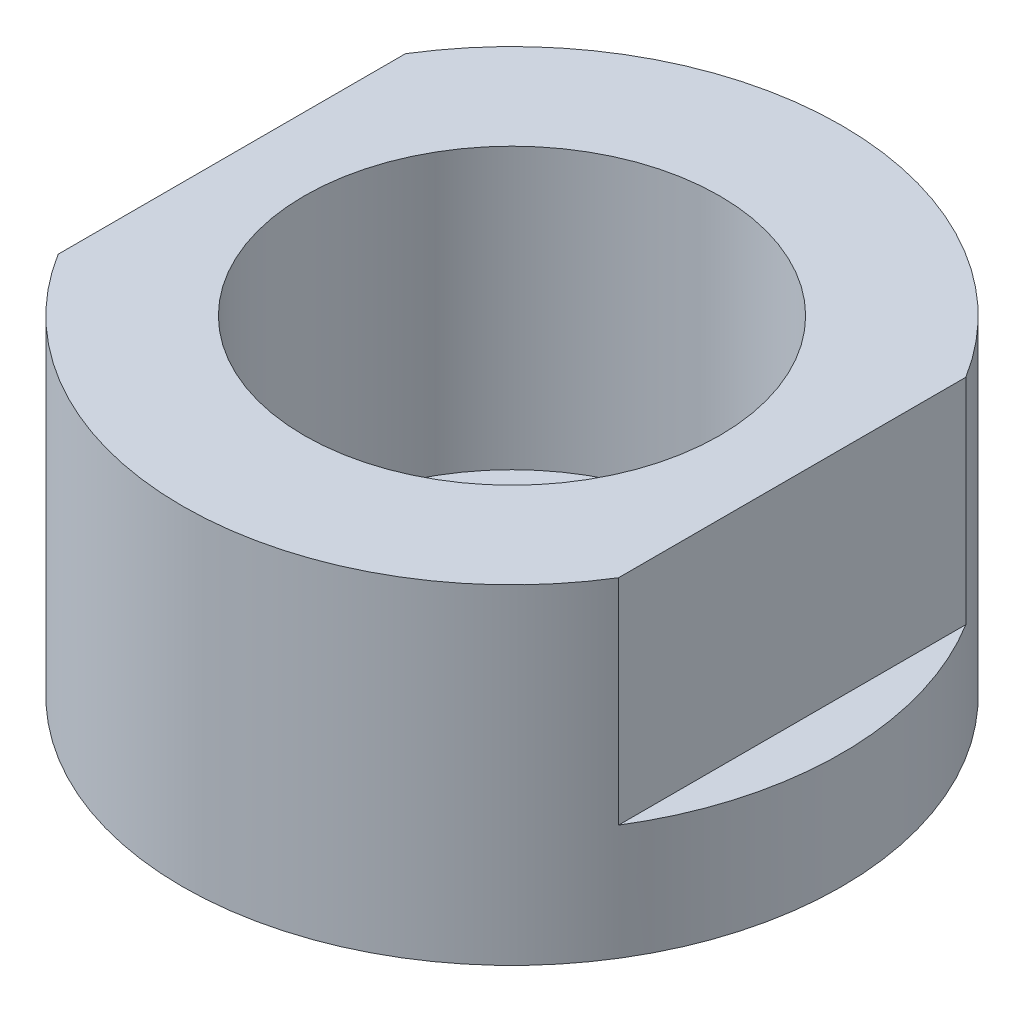
from build123d import *

# Parameters (mm, degrees)
SKETCH1_R                           = 25.4
BOSS_EXTRUDE1_DEPTH                 = 25.4
SKETCH2_R                           = 16
CUT_EXTRUDE1_DEPTH                  = 21.59
CUT_EXTRUDE2_REACH                  = 45.994
CUT_EXTRUDE2_END_RADIUS             = 25.4
SKETCH3_W                           = 3.81
SKETCH3_H                           = 16.51
CUT_EXTRUDE2_DIRECTION_2_REACH      = 45.994
CUT_EXTRUDE2_DIRECTION_2_END_RADIUS = 25.4
CUT_EXTRUDE3_REACH                  = 43.91
SKETCH4_R                           = 1


with BuildPart() as part:
    # Sketch1 → Boss-Extrude1 (new body)
    with BuildSketch(Plane(origin=(0, 0, 0), x_dir=(1, 0, 0), z_dir=(0, 1, 0))):
        with Locations(Location((0, 0, 0), (0, 0, 270))):
            Circle(SKETCH1_R)
    extrude(amount=BOSS_EXTRUDE1_DEPTH)

    # Sketch2 → Cut-Extrude1 (cut)
    with BuildSketch(Plane(origin=(0, 25.4, 0), x_dir=(1, 0, 0), z_dir=(0, 1, 0))):
        with Locations(Location((0, 0, 0), (0, 0, 270))):
            Circle(SKETCH2_R)
    extrude(amount=-CUT_EXTRUDE1_DEPTH, mode=Mode.SUBTRACT)

    # Cut-Extrude2: up to this cylinder (the profile starts inside it)
    cut_extrude2_end = Plane(origin=(0, 17.145, 0), z_dir=(0, -1, 0)) * Cylinder(CUT_EXTRUDE2_END_RADIUS, 143.788, mode=Mode.PRIVATE)
    # Sketch3 → Cut-Extrude2 (cut, up to the surface)
    with BuildSketch(Plane.XY, mode=Mode.PRIVATE) as cut_extrude2_sk1:
        with Locations((23.495, 17.145)):
            Rectangle(SKETCH3_W, SKETCH3_H)
    cut_extrude2_tool1 = extrude(cut_extrude2_sk1.sketch, amount=-CUT_EXTRUDE2_REACH, mode=Mode.PRIVATE) & cut_extrude2_end
    add(cut_extrude2_tool1.solids().sort_by_distance((23.495, 17.145, 0))[0], mode=Mode.SUBTRACT)
    # Sketch3 → Cut-Extrude2 (cut, up to the surface)
    with BuildSketch(Plane.XY, mode=Mode.PRIVATE) as cut_extrude2_sk2:
        with Locations((-23.495, 17.145)):
            Rectangle(SKETCH3_W, SKETCH3_H)
    cut_extrude2_tool2 = extrude(cut_extrude2_sk2.sketch, amount=-CUT_EXTRUDE2_REACH, mode=Mode.PRIVATE) & cut_extrude2_end
    add(cut_extrude2_tool2.solids().sort_by_distance((-23.495, 17.145, 0))[0], mode=Mode.SUBTRACT)

    # Cut-Extrude2 direction 2: up to this cylinder (the profile starts inside it)
    cut_extrude2_direction_2_end = Plane(origin=(0, 17.145, 0), z_dir=(0, -1, 0)) * Cylinder(CUT_EXTRUDE2_DIRECTION_2_END_RADIUS, 143.788, mode=Mode.PRIVATE)
    # Sketch3 → Cut-Extrude2 direction 2 (cut, up to the surface)
    with BuildSketch(Plane.XY, mode=Mode.PRIVATE) as cut_extrude2_direction_2_sk1:
        with Locations((23.495, 17.145)):
            Rectangle(SKETCH3_W, SKETCH3_H)
    cut_extrude2_direction_2_tool1 = extrude(cut_extrude2_direction_2_sk1.sketch, amount=CUT_EXTRUDE2_DIRECTION_2_REACH, mode=Mode.PRIVATE) & cut_extrude2_direction_2_end
    add(cut_extrude2_direction_2_tool1.solids().sort_by_distance((23.495, 17.145, 0))[0], mode=Mode.SUBTRACT)
    # Sketch3 → Cut-Extrude2 direction 2 (cut, up to the surface)
    with BuildSketch(Plane.XY, mode=Mode.PRIVATE) as cut_extrude2_direction_2_sk2:
        with Locations((-23.495, 17.145)):
            Rectangle(SKETCH3_W, SKETCH3_H)
    cut_extrude2_direction_2_tool2 = extrude(cut_extrude2_direction_2_sk2.sketch, amount=CUT_EXTRUDE2_DIRECTION_2_REACH, mode=Mode.PRIVATE) & cut_extrude2_direction_2_end
    add(cut_extrude2_direction_2_tool2.solids().sort_by_distance((-23.495, 17.145, 0))[0], mode=Mode.SUBTRACT)

    # Sketch4 → Cut-Extrude3 (cut, up to next)
    with BuildSketch(Plane(origin=(0, 3.81, 0), x_dir=(1, 0, 0), z_dir=(0, 1, 0)), mode=Mode.PRIVATE) as cut_extrude3_sk1:
        with Locations(Location((0, 8.89, 0), (0, 0, 270))):
            Circle(SKETCH4_R)
    cut_extrude3_tool1 = extrude(cut_extrude3_sk1.sketch, amount=-CUT_EXTRUDE3_REACH, mode=Mode.PRIVATE) & part.part
    # Sketch4 → Cut-Extrude3 (cut, up to next)
    with BuildSketch(Plane(origin=(0, 3.81, 0), x_dir=(1, 0, 0), z_dir=(0, 1, 0)), mode=Mode.PRIVATE) as cut_extrude3_sk2:
        with Locations(Location((7.69896584, -4.445, 0), (0, 0, 270))):
            Circle(SKETCH4_R)
    cut_extrude3_tool2 = extrude(cut_extrude3_sk2.sketch, amount=-CUT_EXTRUDE3_REACH, mode=Mode.PRIVATE) & part.part
    # Sketch4 → Cut-Extrude3 (cut, up to next)
    with BuildSketch(Plane(origin=(0, 3.81, 0), x_dir=(1, 0, 0), z_dir=(0, 1, 0)), mode=Mode.PRIVATE) as cut_extrude3_sk3:
        with Locations(Location((-7.69896584, -4.445, 0), (0, 0, 270))):
            Circle(SKETCH4_R)
    cut_extrude3_tool3 = extrude(cut_extrude3_sk3.sketch, amount=-CUT_EXTRUDE3_REACH, mode=Mode.PRIVATE) & part.part
    add(cut_extrude3_tool1.solids().sort_by_distance((0, 3.81, -8.89))[0], mode=Mode.SUBTRACT)
    add(cut_extrude3_tool2.solids().sort_by_distance((7.698966, 3.81, 4.445))[0], mode=Mode.SUBTRACT)
    add(cut_extrude3_tool3.solids().sort_by_distance((-7.698966, 3.81, 4.445))[0], mode=Mode.SUBTRACT)


solid = part.part
